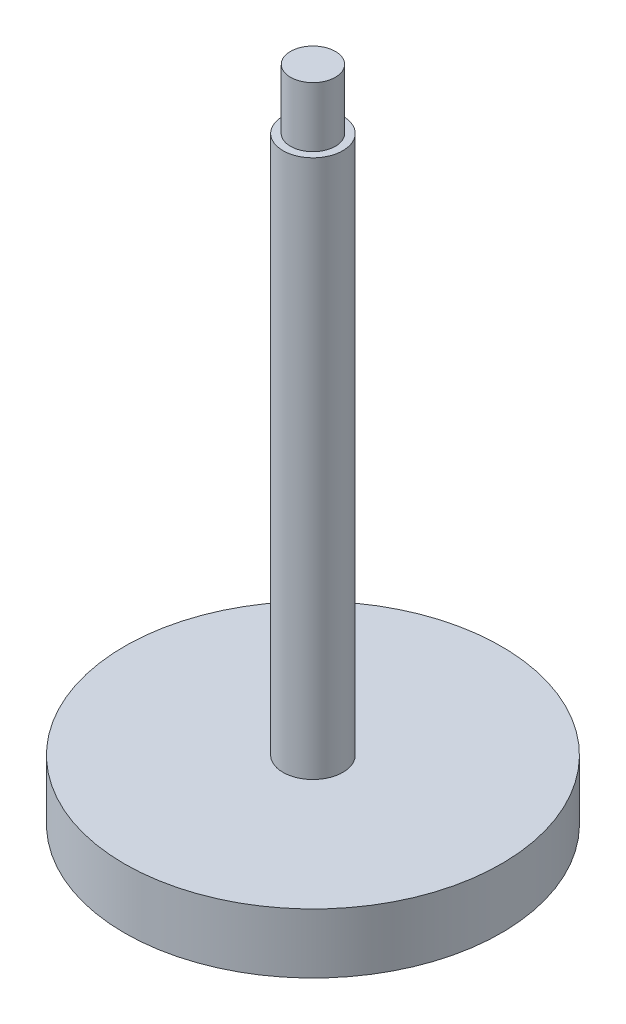
from build123d import *

# Parameters (mm, degrees)
SKETCH1_R           = 63
BOSS_EXTRUDE1_DEPTH = 20
SKETCH2_R           = 10
BOSS_EXTRUDE2_DEPTH = 200
SKETCH3_OUTSIDE_W   = 184.622
SKETCH3_OUTSIDE_H   = 184.622
SKETCH3_OUTSIDE_R   = 7.5
CUT_EXTRUDE1_DEPTH  = 20


with BuildPart() as part:
    # Sketch1 → Boss-Extrude1 (new body)
    with BuildSketch(Plane(origin=(0, 0, 0), x_dir=(1, 0, 0), z_dir=(0, 1, 0))):
        with Locations(Location((0, 0, 0), (0, 0, 270))):
            Circle(SKETCH1_R)
    extrude(amount=BOSS_EXTRUDE1_DEPTH)

    # Sketch2 → Boss-Extrude2 (add)
    with BuildSketch(Plane(origin=(0, 20, 0), x_dir=(1, 0, 0), z_dir=(0, 1, 0))):
        with Locations(Location((0, 0, 0), (0, 0, 270))):
            Circle(SKETCH2_R)
    extrude(amount=BOSS_EXTRUDE2_DEPTH)

    # Sketch3 outside → Cut-Extrude1 (cut)
    with BuildSketch(Plane(origin=(0, 220, 0), x_dir=(1, 0, 0), z_dir=(0, 1, 0))):
        Rectangle(SKETCH3_OUTSIDE_W, SKETCH3_OUTSIDE_H)
        with Locations(Location((0, 0, 0), (0, 0, 270))):
            Circle(SKETCH3_OUTSIDE_R, mode=Mode.SUBTRACT)
    extrude(amount=-CUT_EXTRUDE1_DEPTH, mode=Mode.SUBTRACT)


solid = part.part
